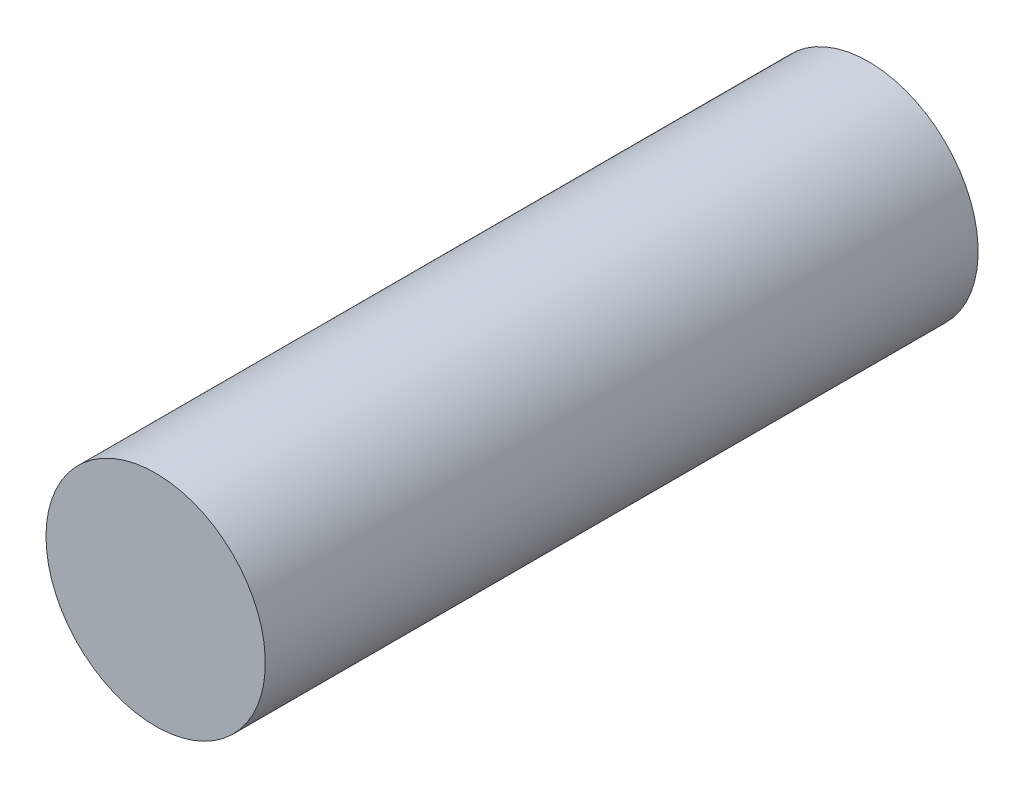
from build123d import *

# Parameters (mm, degrees)
SCHIZZO1_R                   = 8
ESTRUSIONE_ESTRUSIONE1_DEPTH = 52


with BuildPart() as part:
    # Schizzo1 → Estrusione-Estrusione1 (new body)
    with BuildSketch(Plane.XY):
        with Locations(Location((0, 0, 0), (0, 0, 180))):
            Circle(SCHIZZO1_R)
    extrude(amount=ESTRUSIONE_ESTRUSIONE1_DEPTH)


solid = part.part
